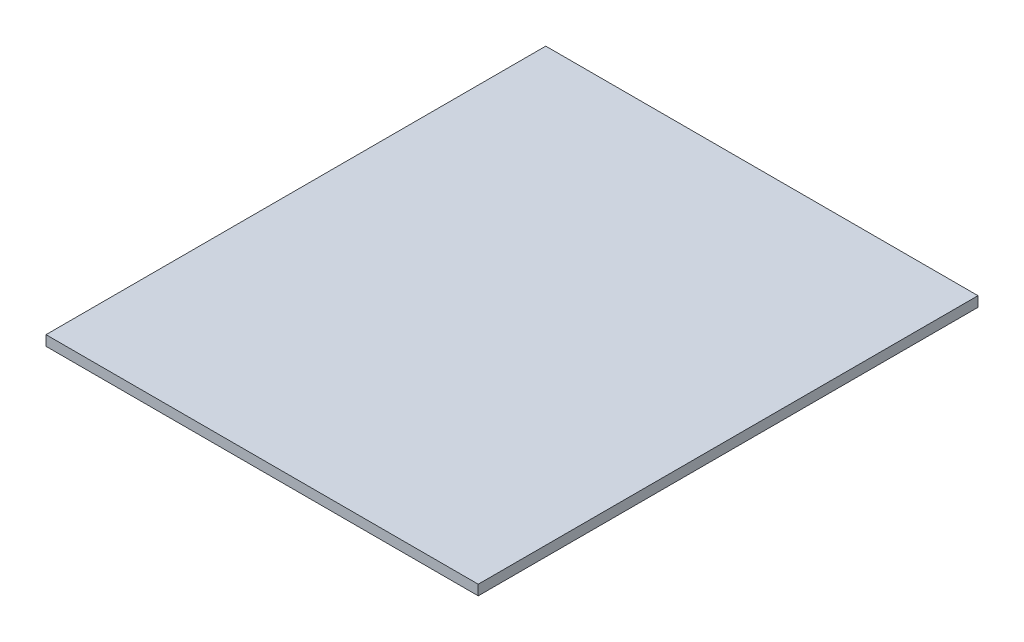
from build123d import *

# Parameters (mm, degrees)
SKETCH1_W           = 64
SKETCH1_H           = 74
BOSS_EXTRUDE1_DEPTH = 1.5


with BuildPart() as part:
    # Sketch1 → Boss-Extrude1 (new body)
    with BuildSketch(Plane(origin=(0, 0, 0), x_dir=(1, 0, 0), z_dir=(0, 1, 0))):
        Rectangle(SKETCH1_W, SKETCH1_H)
    extrude(amount=BOSS_EXTRUDE1_DEPTH)


solid = part.part
